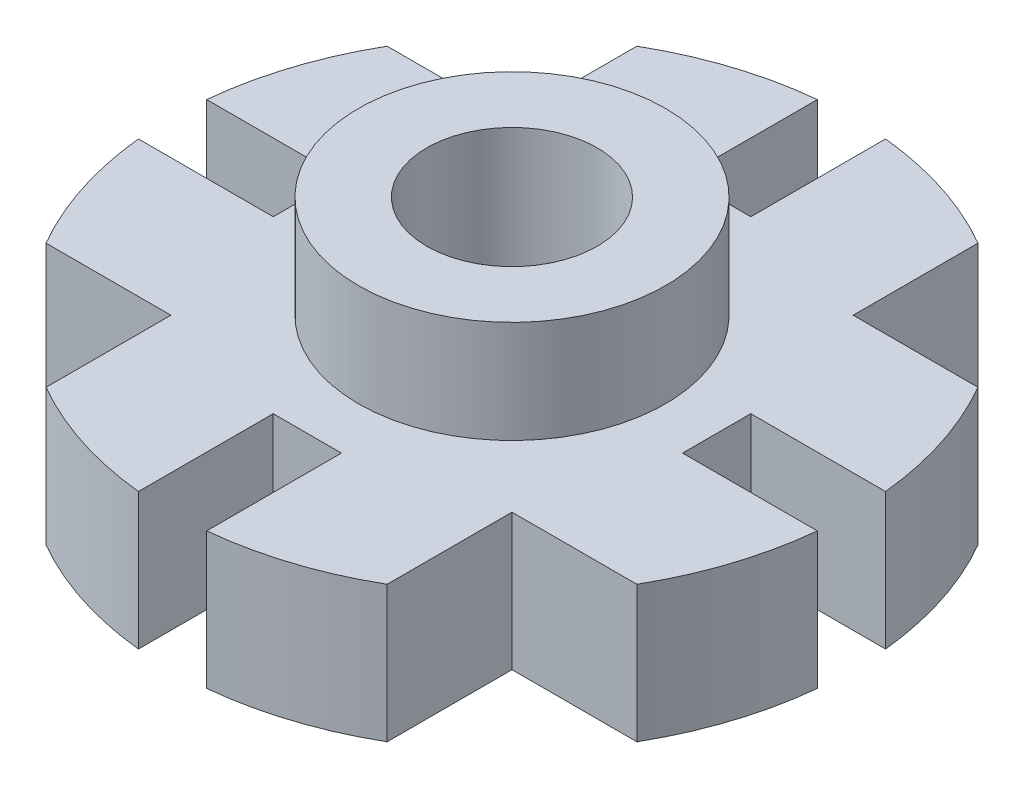
from build123d import *

# Parameters (mm, degrees)
SKETCH5_R           = 63.5
BOSS_EXTRUDE4_DEPTH = 25.4
CUT_EXTRUDE1_START  = -25.4
CUT_EXTRUDE1_DEPTH  = 25.4
SKETCH7_W           = 32.207696565
SKETCH7_H           = 29.034850548
SKETCH7_W_2         = 40.840963154
SKETCH7_H_2         = 50.8
SKETCH7_W_3         = 50.8
SKETCH7_H_3         = 46.127593635
SKETCH7_W_4         = 52.340186774
SKETCH7_H_4         = 47.821811578
CUT_EXTRUDE2_DEPTH  = 25.4
SKETCH8_R           = 28.575
BOSS_EXTRUDE5_DEPTH = 19.05
SKETCH12_R          = 15.875
CUT_EXTRUDE3_DEPTH  = 72.644


with BuildPart() as part:
    # Sketch5 → Boss-Extrude4 (new body)
    with BuildSketch(Plane(origin=(0, 0, 0), x_dir=(1, 0, 0), z_dir=(0, 1, 0))):
        with Locations(Location((20.708940373, 32.941168468, 0), (0, 0, 270))):
            Circle(SKETCH5_R)
    extrude(amount=BOSS_EXTRUDE4_DEPTH)

    # Sketch6 → Cut-Extrude1 (cut)
    with BuildSketch(Plane(origin=(0, 25.4, 0), x_dir=(1, 0, 0), z_dir=(0, 1, 0)).offset(CUT_EXTRUDE1_START)):
        with BuildLine():
            Line((84.208940373, 32.941168468), (58.808940373, 32.941168468))
            Line((58.808940373, 32.941168468), (58.808940373, 26.591168468))
            Line((58.808940373, 26.591168468), (83.890642629, 26.591168468))
            ThreePointArc((83.890642629, 26.591168468), (84.129316015, 29.762182251), (84.208940373, 32.941168468))
        make_face()
        with BuildLine():
            Line((58.808940373, 39.291168468), (58.808940373, 32.941168468))
            Line((58.808940373, 32.941168468), (84.208940373, 32.941168468))
            ThreePointArc((84.208940373, 32.941168468), (84.129316015, 36.120154684), (83.890642629, 39.291168468))
            Line((83.890642629, 39.291168468), (58.808940373, 39.291168468))
        make_face()
        with BuildLine():
            Line((20.708940373, 96.441168468), (20.708940373, 71.041168468))
            Line((20.708940373, 71.041168468), (27.058940373, 71.041168468))
            Line((27.058940373, 71.041168468), (27.058940373, 96.122870724))
            ThreePointArc((27.058940373, 96.122870724), (23.887926589, 96.36154411), (20.708940373, 96.441168468))
        make_face()
        with BuildLine():
            Line((14.358940373, 71.041168468), (20.708940373, 71.041168468))
            Line((20.708940373, 71.041168468), (20.708940373, 96.441168468))
            ThreePointArc((20.708940373, 96.441168468), (17.529954156, 96.36154411), (14.358940373, 96.122870724))
            Line((14.358940373, 96.122870724), (14.358940373, 71.041168468))
        make_face()
        with BuildLine():
            Line((-42.791059627, 32.941168468), (-17.391059627, 32.941168468))
            Line((-17.391059627, 32.941168468), (-17.391059627, 39.291168468))
            Line((-17.391059627, 39.291168468), (-42.472761884, 39.291168468))
            ThreePointArc((-42.472761884, 39.291168468), (-42.711435268, 36.120154731), (-42.791059627, 32.941168563))
        make_face()
        with BuildLine():
            Line((-17.391059627, 26.591168468), (-17.391059627, 32.941168468))
            Line((-17.391059627, 32.941168468), (-42.791059627, 32.941168468))
            ThreePointArc((-42.791059627, 32.941168563), (-42.711435272, 29.762182299), (-42.472761884, 26.591168468))
            Line((-42.472761884, 26.591168468), (-17.391059627, 26.591168468))
        make_face()
        with BuildLine():
            Line((20.708940373, -30.558831532), (20.708940373, -5.158831532))
            Line((20.708940373, -5.158831532), (14.358940373, -5.158831532))
            Line((14.358940373, -5.158831532), (14.358940373, -30.240533789))
            ThreePointArc((14.358940373, -30.240533789), (17.529954156, -30.479207175), (20.708940373, -30.558831532))
        make_face()
        with BuildLine():
            Line((27.058940373, -5.158831532), (20.708940373, -5.158831532))
            Line((20.708940373, -5.158831532), (20.708940373, -30.558831532))
            ThreePointArc((20.708940373, -30.558831532), (23.887926589, -30.479207175), (27.058940373, -30.240533789))
            Line((27.058940373, -30.240533789), (27.058940373, -5.158831532))
        make_face()
    extrude(amount=CUT_EXTRUDE1_DEPTH, mode=Mode.SUBTRACT)

    # Sketch7 → Cut-Extrude2 (cut)
    with BuildSketch(Plane(origin=(0, 25.4, 0), x_dir=(1, 0, 0), z_dir=(0, 1, 0))):
        with Locations((68.562788656, -13.326256806)):
            Rectangle(SKETCH7_W, SKETCH7_H)
        with Locations((-31.461541204, -24.208831532)):
            Rectangle(SKETCH7_W_2, SKETCH7_H_2)
        with Locations((-36.441059627, 87.754965286)):
            Rectangle(SKETCH7_W_3, SKETCH7_H_3)
        with Locations((78.62903376, 88.602074257)):
            Rectangle(SKETCH7_W_4, SKETCH7_H_4)
    extrude(amount=-CUT_EXTRUDE2_DEPTH, mode=Mode.SUBTRACT)

    # Sketch8 → Boss-Extrude5 (add)
    with BuildSketch(Plane(origin=(0, 25.4, 0), x_dir=(1, 0, 0), z_dir=(0, 1, 0))):
        with Locations(Location((20.708940373, 32.941168468, 0), (0, 0, 90))):
            Circle(SKETCH8_R)
    extrude(amount=BOSS_EXTRUDE5_DEPTH)

    # Sketch12 → Cut-Extrude3 (cut)
    with BuildSketch(Plane(origin=(0, 44.45, 0), x_dir=(1, 0, 0), z_dir=(0, 1, 0))):
        with Locations(Location((20.708940373, 32.941168468, 0), (0, 0, 270))):
            Circle(SKETCH12_R)
    extrude(amount=-CUT_EXTRUDE3_DEPTH, mode=Mode.SUBTRACT)


solid = part.part
